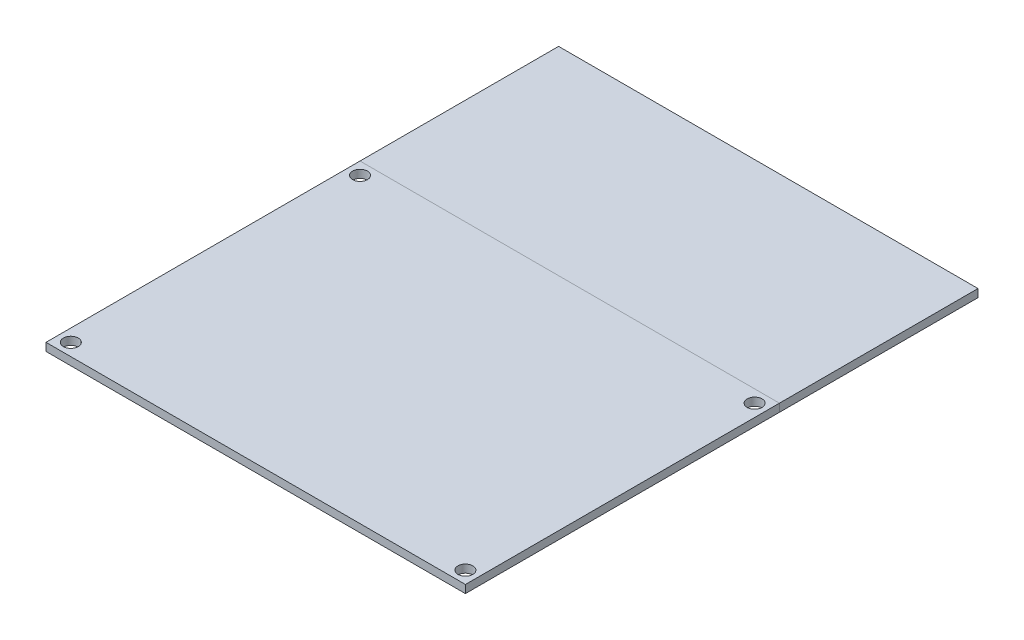
from build123d import *

# Parameters (mm, degrees)
SKETCH1_W           = 84.48
SKETCH1_H           = 63.25
SKETCH1_R           = 1.5
BOSS_EXTRUDE1_DEPTH = 1.6
SKETCH2_W           = 84.48
SKETCH2_H           = 40
BOSS_EXTRUDE2_DEPTH = 1.6


with BuildPart() as part:
    # Sketch1 → Boss-Extrude1 (new body)
    with BuildSketch(Plane(origin=(0, 0, 0), x_dir=(1, 0, 0), z_dir=(0, 1, 0))):
        Rectangle(SKETCH1_W, SKETCH1_H)
        with Locations(Location((-39.74, 29.125, 0), (0, 0, 270))):
            Circle(SKETCH1_R, mode=Mode.SUBTRACT)
        with Locations(Location((-39.74, -29.125, 0), (0, 0, 90))):
            Circle(SKETCH1_R, mode=Mode.SUBTRACT)
        with Locations(Location((39.74, -29.125, 0), (0, 0, 270))):
            Circle(SKETCH1_R, mode=Mode.SUBTRACT)
        with Locations(Location((39.74, 29.125, 0), (0, 0, 90))):
            Circle(SKETCH1_R, mode=Mode.SUBTRACT)
    extrude(amount=BOSS_EXTRUDE1_DEPTH)


with BuildPart() as body_2:
    # Sketch2 → Boss-Extrude2 (new body)
    with BuildSketch(Plane(origin=(0, 0, 0), x_dir=(1, 0, 0), z_dir=(0, 1, 0))):
        with Locations((0, 51.625)):
            Rectangle(SKETCH2_W, SKETCH2_H)
    extrude(amount=BOSS_EXTRUDE2_DEPTH)


solid = Compound([part.part, body_2.part])
